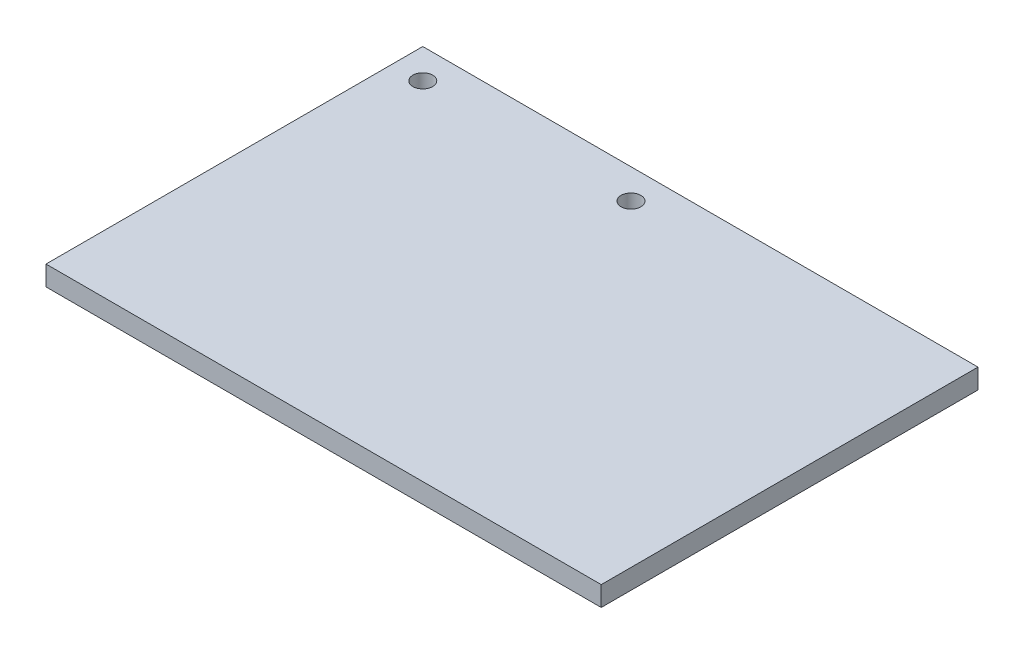
from build123d import *

# Parameters (mm, degrees)
CROQUIS1_W              = 280
CROQUIS1_H              = 190
SALIENTE_EXTRUIR1_DEPTH = 10
CROQUIS2_R              = 5
CORTAR_EXTRUIR1_DEPTH   = 10


with BuildPart() as part:
    # Croquis1 → Saliente-Extruir1 (new body)
    with BuildSketch(Plane(origin=(0, 0, 0), x_dir=(1, 0, 0), z_dir=(0, 1, 0))):
        Rectangle(CROQUIS1_W, CROQUIS1_H)
    extrude(amount=SALIENTE_EXTRUIR1_DEPTH)

    # Croquis2 → Cortar-Extruir1 (cut)
    with BuildSketch(Plane(origin=(0, 10, 0), x_dir=(1, 0, 0), z_dir=(0, 1, 0))):
        with Locations(Location((-125, 80, 0), (0, 0, 270))):
            Circle(CROQUIS2_R)
        with Locations(Location((-20, 80, 0), (0, 0, 270))):
            Circle(CROQUIS2_R)
    extrude(amount=-CORTAR_EXTRUIR1_DEPTH, mode=Mode.SUBTRACT)


solid = part.part
